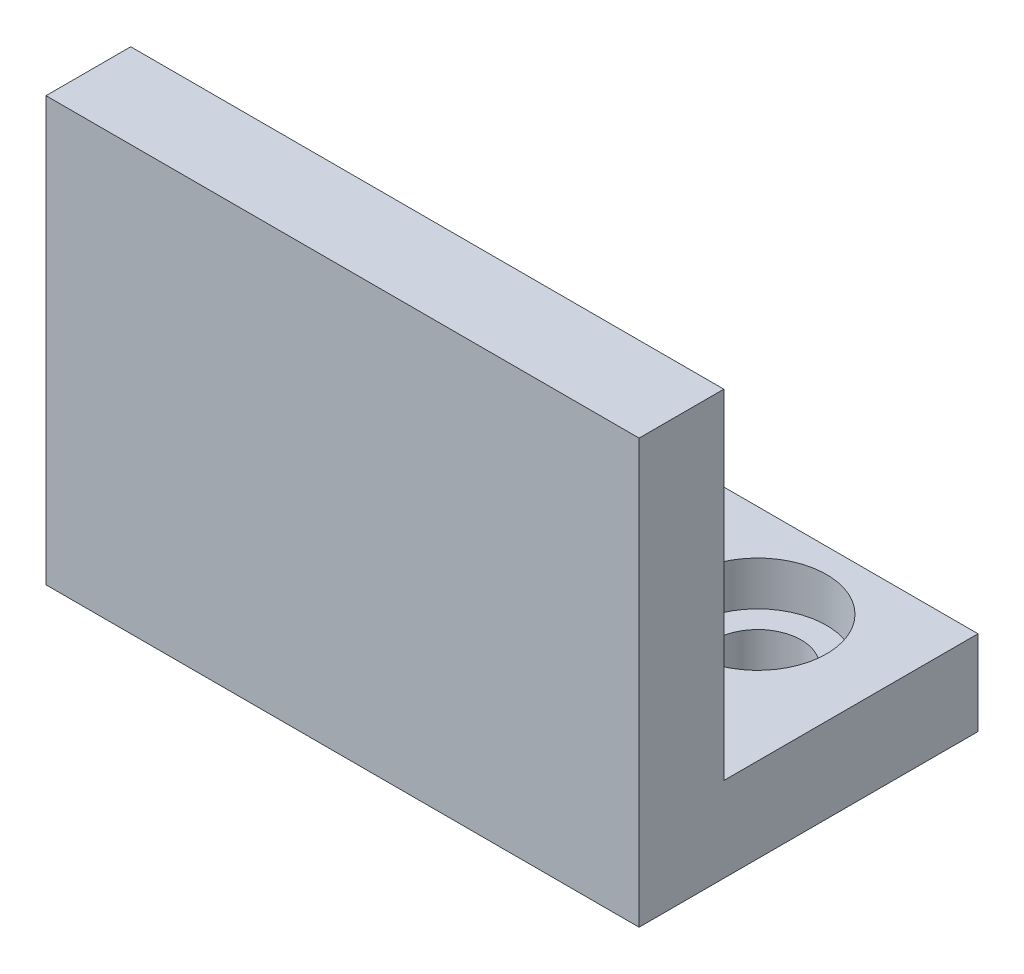
from build123d import *

# Parameters (mm, degrees)
BOSS_EXTRUDE1_DEPTH                              = 44.45
CBORE_FOR_1_4_SOCKET_SHOULDER_SCREW1_D           = 6.5278
CBORE_FOR_1_4_SOCKET_SHOULDER_SCREW1_CBORE_D     = 10.31748
CBORE_FOR_1_4_SOCKET_SHOULDER_SCREW1_CBORE_DEPTH = 3.302


with BuildPart() as part:
    # Sketch1 → Boss-Extrude1 (new body)
    with BuildSketch(Plane(origin=(0, 0, 0), x_dir=(0, 0, -1), z_dir=(1, 0, 0))):
        Polygon((-25.4, 31.75), (-19.05, 31.75), (-19.05, 6.35), (0, 6.35), (0, 0), (-25.4, 0), align=None)
    extrude(amount=BOSS_EXTRUDE1_DEPTH)

    # CBORE for 1/4 Socket Shoulder Screw1 (through all)
    with Locations(Plane(origin=(0, 6.35, 0), x_dir=(1, 0, 0), z_dir=(0, 1, 0))):
        with Locations((9.525, -6.985), (34.925, -6.985)):
            CounterBoreHole(CBORE_FOR_1_4_SOCKET_SHOULDER_SCREW1_D / 2, CBORE_FOR_1_4_SOCKET_SHOULDER_SCREW1_CBORE_D / 2, CBORE_FOR_1_4_SOCKET_SHOULDER_SCREW1_CBORE_DEPTH)


solid = part.part
